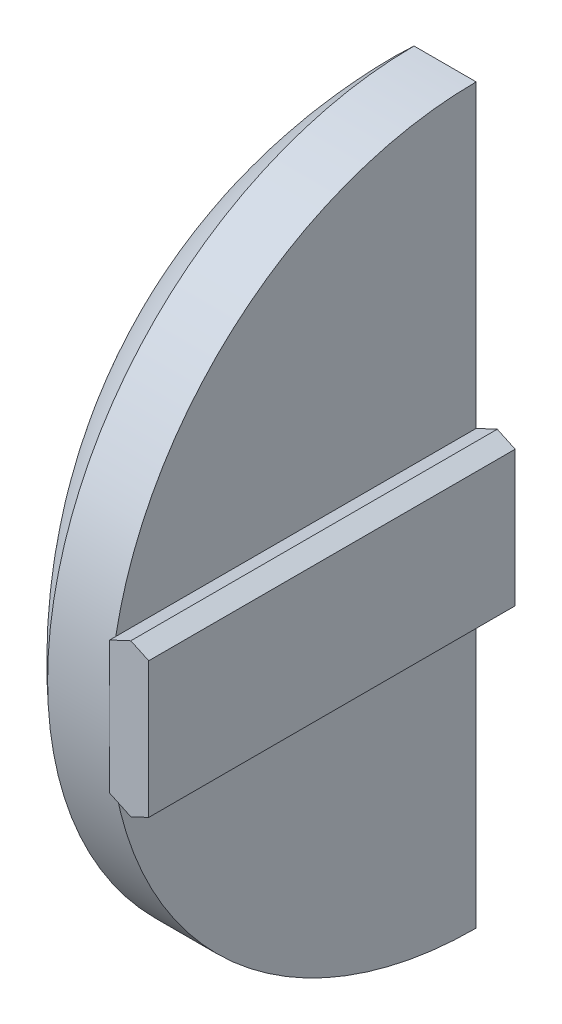
from build123d import *

# Parameters (mm, degrees)
BOSS_EXTRUDE1_DEPTH = 29.5
SKETCH4_W           = 50
SKETCH4_H           = 35
CUT_EXTRUDE1_DEPTH  = 68
SKETCH5_W           = 15.381078853
SKETCH5_H           = 2.6
CUT_EXTRUDE2_DEPTH  = 2


with BuildPart() as part:
    # Sketch1 → Boss-Extrude1 (new body)
    with BuildSketch(Plane.XY):
        Polygon((-22.49, 37.442535728), (-20.79, 38.235869061), (-19.35, 37.563869061), (-19.35, 26.640292624), (-20.79, 25.968292624), (-22.49, 26.761625958), align=None)
    extrude(amount=-BOSS_EXTRUDE1_DEPTH)

    # Sketch3 → Revolve1 (revolve)
    with BuildSketch(Plane(origin=(0, 32.102080843, 0), x_dir=(-1, 0, 0), z_dir=(0, -1, 0)), mode=Mode.PRIVATE) as revolve1_sk:
        with BuildLine():
            Line((22.49, 29.5), (40.49, 29.5))
            ThreePointArc((40.49, 29.5), (37.113405562, 13.37358399), (27.49, 0))
            Line((27.49, 0), (22.49, 0))
            Line((22.49, 0), (22.49, 29.5))
        make_face()
        with BuildLine():
            Line((23.79, 28.2), (39.171078853, 28.2))
            ThreePointArc((39.171078853, 28.2), (35.761046656, 13.533638438), (26.982175907, 1.3))
            Line((26.982175907, 1.3), (23.79, 1.3))
            Line((23.79, 1.3), (23.79, 28.2))
        make_face(mode=Mode.SUBTRACT)
    revolve(revolve1_sk.sketch.rotate(Axis((-22.49, 32.102080843, -29.5), (-1, 0, 0)), 90), axis=Axis((-22.49, 32.102080843, -29.5), (-1, 0, 0)))

    # Sketch4 → Cut-Extrude1 (cut)
    with BuildSketch(Plane(origin=(0, 0, 0), x_dir=(1, 0, 0), z_dir=(0, 1, 0))):
        with Locations((-35.281230145, 47)):
            Rectangle(SKETCH4_W, SKETCH4_H)
    extrude(amount=CUT_EXTRUDE1_DEPTH, mode=Mode.SUBTRACT)

    # Sketch5 → Cut-Extrude2 (cut)
    with BuildSketch(Plane(origin=(0, 0, -29.5), x_dir=(-1, 0, 0), z_dir=(0, 0, -1))):
        with Locations((31.480539427, 32.102080843)):
            Rectangle(SKETCH5_W, SKETCH5_H)
    extrude(amount=-CUT_EXTRUDE2_DEPTH, mode=Mode.SUBTRACT)


solid = part.part
